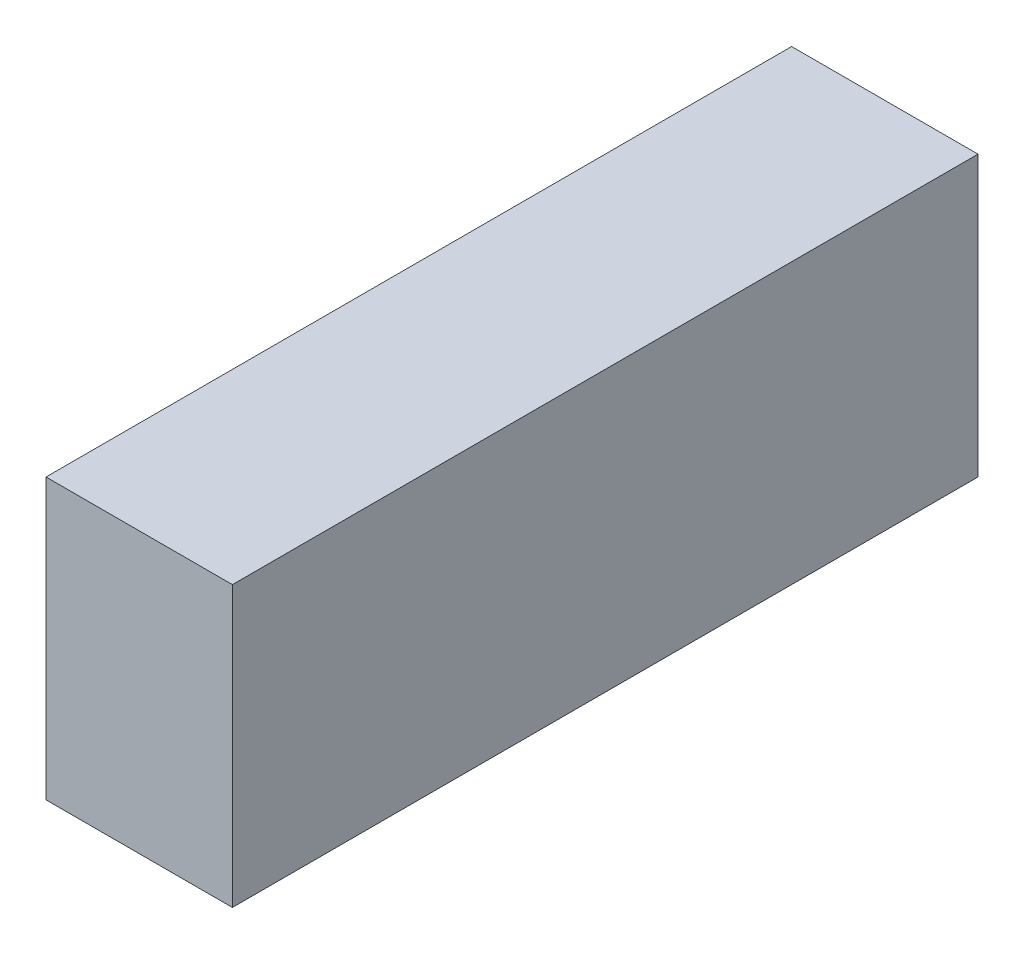
from build123d import *

# Parameters (mm, degrees)
CEK_ICECEK_KAYIS_BAGLANTI_PABUCU_1_START = -40
SKETCH1_W                                = 10
SKETCH1_H                                = 15
CEK_ICECEK_KAYIS_BAGLANTI_PABUCU_1_DEPTH = 40


with BuildPart() as part:
    # Sketch1 → CEK_icecek_kayis_baglanti_pabucu_1 (new body)
    with BuildSketch(Plane.XY.offset(CEK_ICECEK_KAYIS_BAGLANTI_PABUCU_1_START)):
        with Locations((7, 36.5)):
            Rectangle(SKETCH1_W, SKETCH1_H)
    extrude(amount=-CEK_ICECEK_KAYIS_BAGLANTI_PABUCU_1_DEPTH)


solid = part.part
